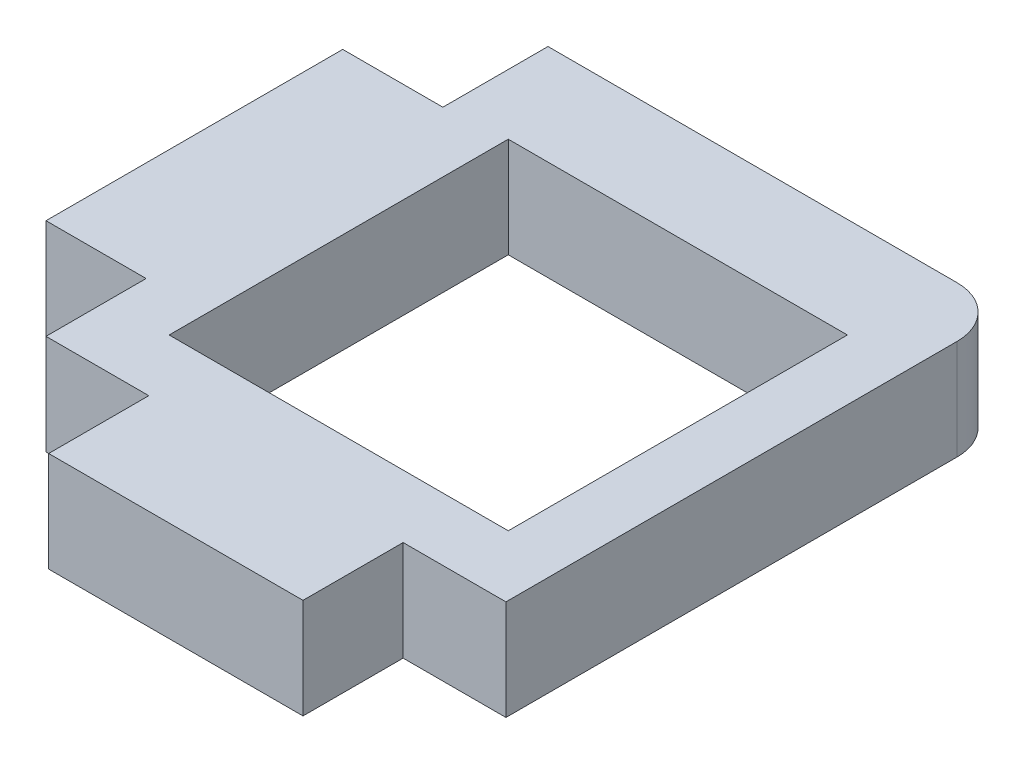
from build123d import *

# Parameters (mm, degrees)
SKETCH_1_W      = 10.16
SKETCH_1_H      = 10.16
EXTRUDE_1_DEPTH = 3


with BuildPart() as part:
    # 스케치1 → 보스-돌출1 (new body)
    with BuildSketch(Plane(origin=(0, 0, 0), x_dir=(1, 0, 0), z_dir=(0, 1, 0))):
        with BuildLine():
            Line((6.88975, 6.0198), (6.88975, 7.4958))
            ThreePointArc((6.88975, 7.4958), (6.443380735, 8.573430735), (5.36575, 9.0198))
            Line((5.36575, 9.0198), (5.08, 9.0198))
            Line((5.08, 9.0198), (-5.08, 9.0198))
            Line((-5.08, 9.0198), (-6.88975, 9.0198))
            Line((-6.88975, 9.0198), (-6.88975, 5.8702))
            Line((-6.88975, 5.8702), (-9.88975, 5.8702))
            Line((-9.88975, 5.8702), (-9.88975, -3.0198))
            Line((-9.88975, -3.0198), (-6.88975, -3.0198))
            Line((-6.88975, -3.0198), (-6.88975, -6.0198))
            Line((-6.88975, -6.0198), (-3.81, -6.0198))
            Line((-3.81, -6.0198), (-3.81, -9.0198))
            Line((-3.81, -9.0198), (3.81, -9.0198))
            Line((3.81, -9.0198), (3.81, -6.0198))
            Line((3.81, -6.0198), (6.88975, -6.0198))
            Line((6.88975, -6.0198), (6.88975, 6.0198))
        make_face()
        with Locations((0, 0.9398)):
            Rectangle(SKETCH_1_W, SKETCH_1_H, mode=Mode.SUBTRACT)
    extrude(amount=-EXTRUDE_1_DEPTH)


solid = part.part
